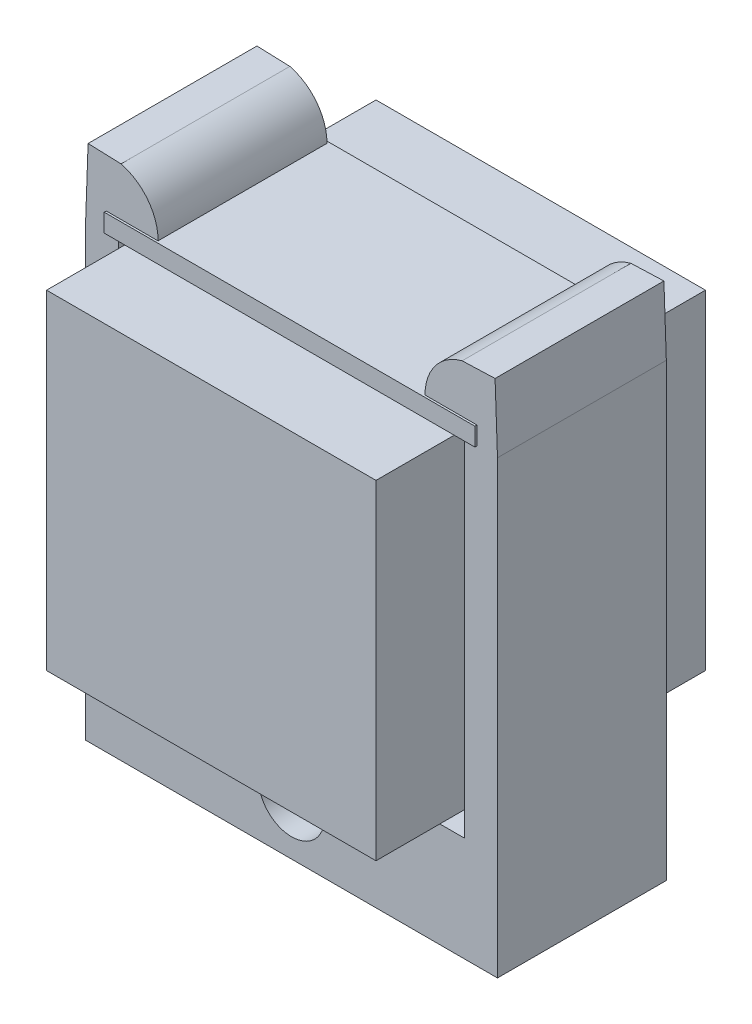
from build123d import *

# Parameters (mm, degrees)
SKETCH1_W                            = 45
SKETCH1_H                            = 21
BOSS_EXTRUDE1_DEPTH                  = 2.2
SKETCH2_W                            = 40
SKETCH2_H                            = 40
BOSS_EXTRUDE2_DEPTH                  = 40
SKETCH3_W                            = 42
SKETCH3_H                            = 12.7
SKETCH3_R                            = 4
SNAPFIT_42MM_SPACING_4MM_WIDTH_DEPTH = 10.25


with BuildPart() as part:
    # Sketch1 → Boss-Extrude1 (new body)
    with BuildSketch(Plane(origin=(0, 0, 0), x_dir=(1, 0, 0), z_dir=(0, 1, 0))):
        Rectangle(SKETCH1_W, SKETCH1_H)
    extrude(amount=BOSS_EXTRUDE1_DEPTH)


with BuildPart() as body_2:
    # Sketch2 → Boss-Extrude2 (new body)
    with BuildSketch(Plane(origin=(0, 0, 0), x_dir=(1, 0, 0), z_dir=(0, 1, 0))):
        Rectangle(SKETCH2_W, SKETCH2_H)
    extrude(amount=-BOSS_EXTRUDE2_DEPTH)


with BuildPart() as body_3:
    # Sketch3 → SnapFit-42mm_spacing-4mm_width (new, symmetric)
    # profile 1 of 3: a face of its own
    with BuildSketch(Plane.XY):
        with Locations((0, -48.35)):
            Rectangle(SKETCH3_W, SKETCH3_H)
        with Locations((0, -48.35)):
            Circle(SKETCH3_R, mode=Mode.SUBTRACT)
    # profile 2 of 3: a face of its own
    with BuildSketch(Plane.XY):
        with BuildLine():
            Line((-25, -54.7), (-21, -54.7))
            Line((-21, -54.7), (-21, -42))
            Line((-21, -42), (-21, 0))
            Line((-21, 0), (-20.921478633, 2.19859828))
            Line((-20.921478633, 2.19859828), (-16.209878032, 2.03032683))
            ThreePointArc((-16.209878032, 2.03032683), (-17.399116467, 5.833874593), (-20.709878032, 8.052009284))
            Line((-20.709878032, 8.052009284), (-24.70732945, 8.194775406))
            Line((-24.70732945, 8.194775406), (-25, 0))
            Line((-25, 0), (-25, -54.7))
        make_face()
    # profile 3 of 3: a face of its own
    with BuildSketch(Plane.XY):
        with BuildLine():
            Line((21, -42), (21, -54.7))
            Line((21, -54.7), (25, -54.7))
            Line((25, -54.7), (25, 0))
            Line((25, 0), (24.70732945, 8.194775406))
            Line((24.70732945, 8.194775406), (20.709878032, 8.052009284))
            ThreePointArc((20.709878032, 8.052009284), (17.399116467, 5.833874593), (16.209878032, 2.03032683))
            Line((16.209878032, 2.03032683), (20.921478633, 2.19859828))
            Line((20.921478633, 2.19859828), (21, 0))
            Line((21, 0), (21, -42))
        make_face()
    extrude(amount=SNAPFIT_42MM_SPACING_4MM_WIDTH_DEPTH, both=True)


solid = Compound([part.part, body_2.part, body_3.part])
